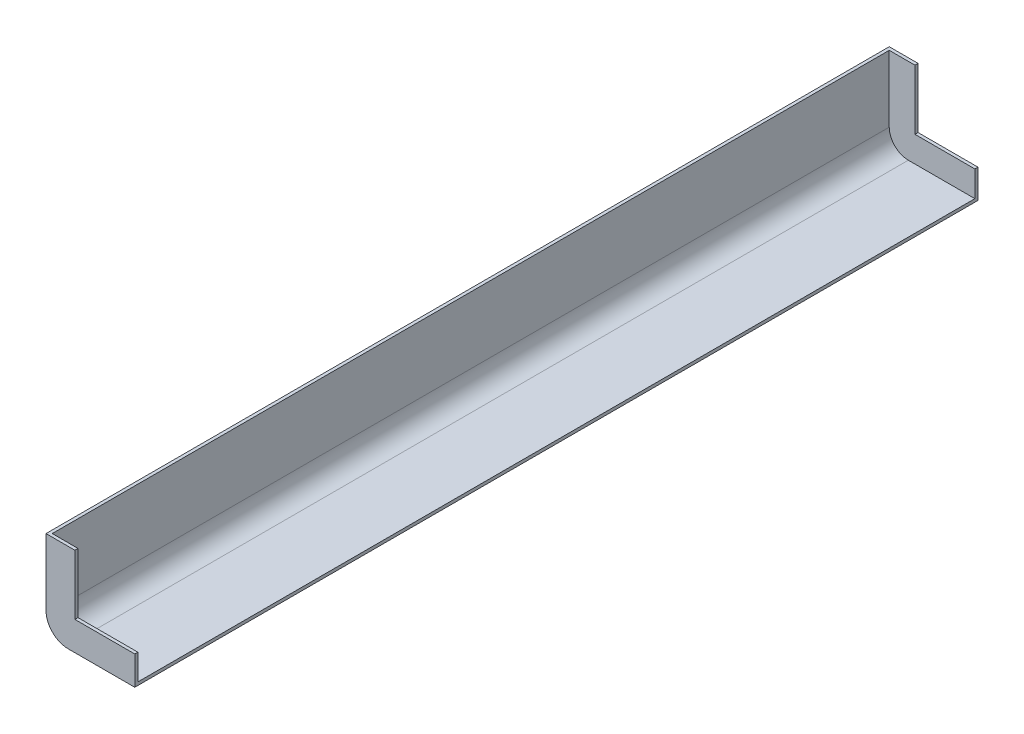
from build123d import *

# Parameters (mm, degrees)
BOSS_EXTRUDE1_DEPTH = 482.6
SHELL1_T            = -1.778


with BuildPart() as part:
    # Sketch1 → Boss-Extrude1 (new body)
    with BuildSketch(Plane.XY):
        with BuildLine():
            Line((0, 12.7), (0, 50.8))
            Line((0, 50.8), (16.51, 50.8))
            Line((16.51, 50.8), (16.51, 16.51))
            Line((16.51, 16.51), (50.8, 16.51))
            Line((50.8, 16.51), (50.8, 0))
            Line((50.8, 0), (12.7, 0))
            ThreePointArc((12.7, 0), (3.719743879, 3.719743879), (0, 12.7))
        make_face()
    extrude(amount=BOSS_EXTRUDE1_DEPTH)

    # Shell1
    shell1_openings = [part.faces().sort_by_distance(p)[0] for p in [
        (16.51, 33.655, 241.3),
        (33.655, 16.51, 241.3),
        (50.8, 8.255, 241.3),
        (8.255, 50.8, 241.3),
    ]]
    offset(amount=SHELL1_T, openings=shell1_openings, kind=Kind.INTERSECTION)


solid = part.part
